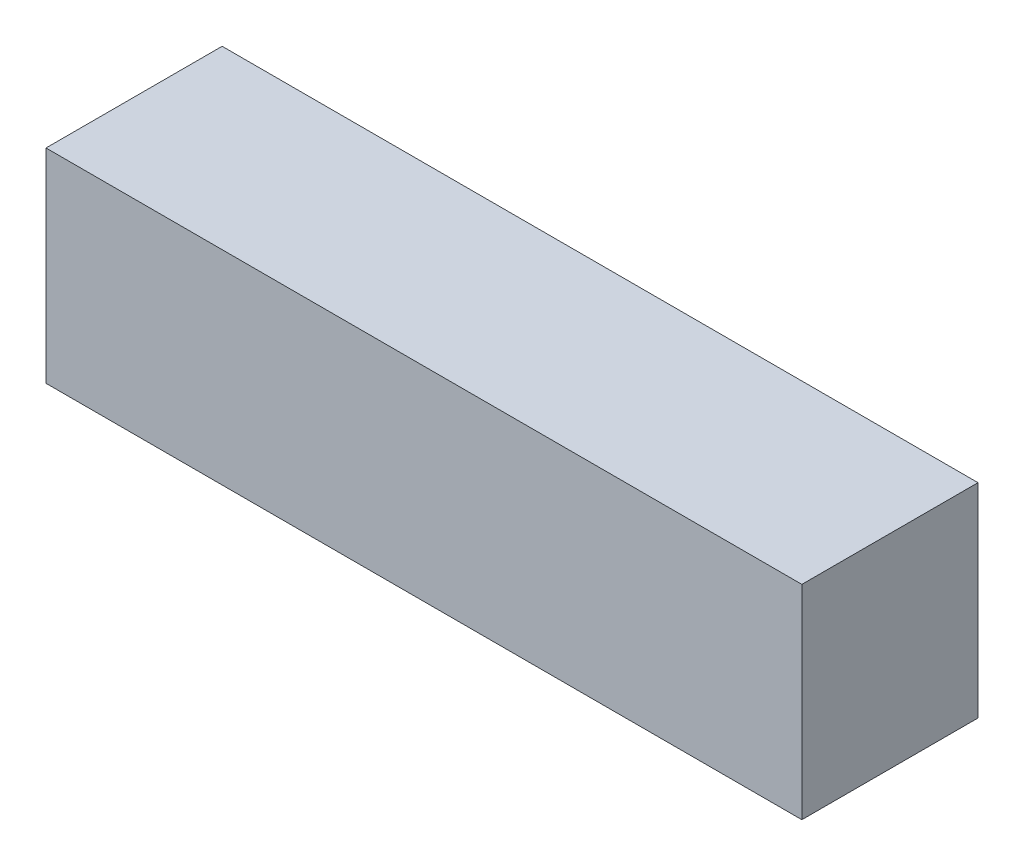
from build123d import *

# Parameters (mm, degrees)
SKETCH2_W           = 103.9876
SKETCH2_H           = 28.0416
BOSS_EXTRUDE1_DEPTH = 24.2316


with BuildPart() as part:
    # Sketch2 → Boss-Extrude1 (new body)
    with BuildSketch(Plane.XY):
        with Locations((51.9938, 14.0208)):
            Rectangle(SKETCH2_W, SKETCH2_H)
    extrude(amount=BOSS_EXTRUDE1_DEPTH)


solid = part.part
